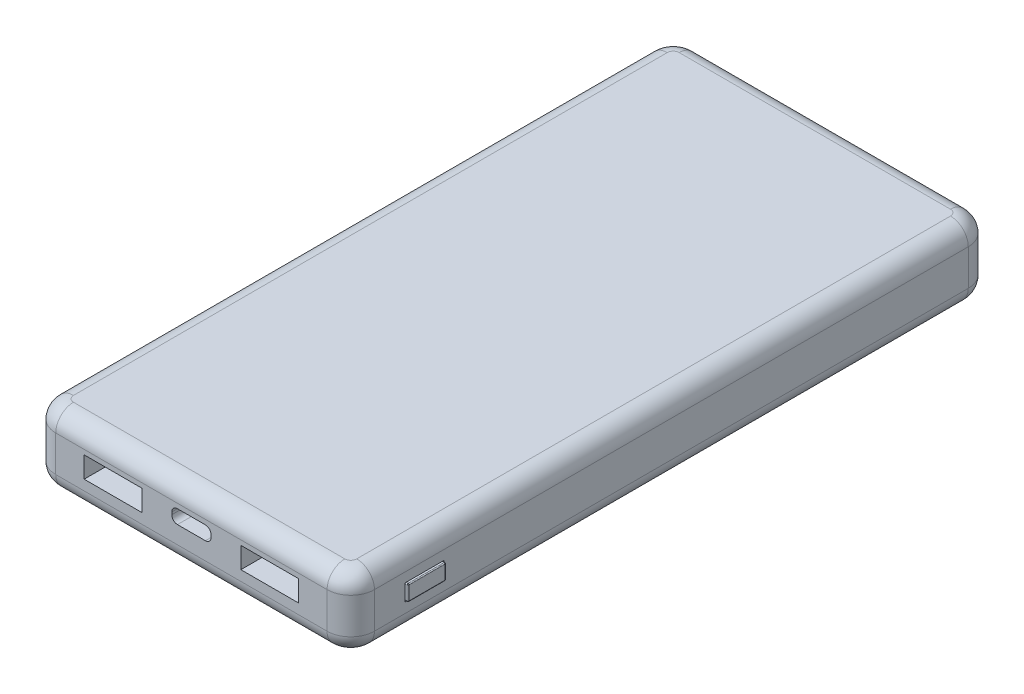
from build123d import *

# Parameters (mm, degrees)
SKETCH1_W           = 67.3
SKETCH1_H           = 135.4
BOSS_EXTRUDE1_DEPTH = 15.1
FILLET1_R           = 5
FILLET2_R           = 3.75
SKETCH2_W           = 12.2
SKETCH2_H           = 4.45
CUT_EXTRUDE1_DEPTH  = 6
SKETCH3_W           = 8.2
SKETCH3_H           = 3.5
SKETCH3_W_2         = 8
SKETCH3_H_2         = 3.3
CUT_EXTRUDE2_DEPTH  = 3
FILLET3_R           = 3.75
SKETCH4_W           = 8
SKETCH4_H           = 3.3
BOSS_EXTRUDE2_DEPTH = 0.5
FILLET4_R           = 0.2
FILLET5_R           = 0.2
BOSS_EXTRUDE3_DEPTH = 2.1


with BuildPart() as part:
    # Sketch1 → Boss-Extrude1 (new body)
    with BuildSketch(Plane(origin=(0, 0, 0), x_dir=(1, 0, 0), z_dir=(0, 1, 0))):
        with Locations((33.65, 67.7)):
            Rectangle(SKETCH1_W, SKETCH1_H)
    extrude(amount=BOSS_EXTRUDE1_DEPTH)

    # Fillet1
    fillet1_edges = [part.edges().sort_by_distance(p)[0] for p in [
        (0, 7.55, -135.4),
        (67.3, 7.55, -135.4),
        (67.3, 7.55, 0),
        (0, 7.55, 0),
    ]]
    fillet(fillet1_edges, radius=FILLET1_R)

    # Fillet2
    fillet2_edges = [part.edges().sort_by_distance(p)[0] for p in [
        (1.464466094, 15.1, -1.464466094),
        (0, 15.1, -67.7),
        (1.464466094, 15.1, -133.935533906),
        (33.65, 15.1, -135.4),
        (65.835533906, 15.1, -133.935533906),
        (67.3, 15.1, -67.7),
        (65.835533906, 15.1, -1.464466094),
        (33.65, 15.1, 0),
    ]]
    fillet(fillet2_edges, radius=FILLET2_R)

    # Sketch2 → Cut-Extrude1 (cut)
    with BuildSketch(Plane.XY):
        with Locations((17.1, 8.125)):
            Rectangle(SKETCH2_W, SKETCH2_H)
        with Locations((50.2, 8.125)):
            Rectangle(SKETCH2_W, SKETCH2_H)
        with BuildLine():
            Line((30.7, 7.45), (36.6, 7.45))
            ThreePointArc((36.6, 7.45), (37.448528137, 7.801471863), (37.8, 8.65))
            Line((37.8, 8.65), (37.8, 9.15))
            ThreePointArc((37.8, 9.15), (37.448528137, 9.998528137), (36.6, 10.35))
            Line((36.6, 10.35), (30.7, 10.35))
            ThreePointArc((30.7, 10.35), (29.851471863, 9.998528137), (29.5, 9.15))
            Line((29.5, 9.15), (29.5, 8.65))
            ThreePointArc((29.5, 8.65), (29.851471863, 7.801471863), (30.7, 7.45))
        make_face()
    extrude(amount=-CUT_EXTRUDE1_DEPTH, mode=Mode.SUBTRACT)

    # Sketch3 → Cut-Extrude2 (cut)
    with BuildSketch(Plane(origin=(67.3, 0, 0), x_dir=(0, 0, -1), z_dir=(1, 0, 0))):
        with Locations((15.6, 7.6)):
            Rectangle(SKETCH3_W, SKETCH3_H)
        with Locations((15.6, 7.6)):
            Rectangle(SKETCH3_W_2, SKETCH3_H_2, mode=Mode.SUBTRACT)
    extrude(amount=-CUT_EXTRUDE2_DEPTH, mode=Mode.SUBTRACT)

    # Fillet3
    fillet3_edges = [part.edges().sort_by_distance(p)[0] for p in [
        (1.464466094, 0, -1.464466094),
        (0, 0, -67.7),
        (1.464466094, 0, -133.935533906),
        (33.65, 0, -135.4),
        (65.835533906, 0, -133.935533906),
        (67.3, 0, -67.7),
        (65.835533906, 0, -1.464466094),
        (33.65, 0, 0),
    ]]
    fillet(fillet3_edges, radius=FILLET3_R)

    # Sketch4 → Boss-Extrude2 (add)
    with BuildSketch(Plane(origin=(67.3, 0, 0), x_dir=(0, 0, -1), z_dir=(1, 0, 0))):
        with Locations((15.6, 7.6)):
            Rectangle(SKETCH4_W, SKETCH4_H)
    extrude(amount=BOSS_EXTRUDE2_DEPTH)

    # Fillet4
    fillet4_edges = [part.edges().sort_by_distance(p)[0] for p in [
        (66.05, 5.95, -11.6),
        (66.05, 5.95, -19.6),
        (66.05, 9.25, -19.6),
        (66.05, 9.25, -11.6),
    ]]
    fillet(fillet4_edges, radius=FILLET4_R)

    # Fillet5
    fillet5_edges = [part.edges().sort_by_distance(p)[0] for p in [
        (67.8, 9.191421356, -19.541421356),
        (67.8, 7.6, -19.6),
        (67.8, 6.008578644, -19.541421356),
        (67.8, 5.95, -15.6),
        (67.8, 6.008578644, -11.658578644),
        (67.8, 7.6, -11.6),
        (67.8, 9.191421356, -11.658578644),
        (67.8, 9.25, -15.6),
    ]]
    fillet(fillet5_edges, radius=FILLET5_R)

    # Sketch5 → Boss-Extrude3 (add)
    with BuildSketch(Plane.XY.offset(-6)):
        with BuildLine():
            Line((30.74, 8.35), (36.56, 8.35))
            ThreePointArc((36.56, 8.35), (36.941837662, 8.508162338), (37.1, 8.89))
            Line((37.1, 8.89), (37.1, 8.91))
            ThreePointArc((37.1, 8.91), (36.941837662, 9.291837662), (36.56, 9.45))
            Line((36.56, 9.45), (30.74, 9.45))
            ThreePointArc((30.74, 9.45), (30.358162338, 9.291837662), (30.2, 8.91))
            Line((30.2, 8.91), (30.2, 8.89))
            ThreePointArc((30.2, 8.89), (30.358162338, 8.508162338), (30.74, 8.35))
        make_face()
    extrude(amount=BOSS_EXTRUDE3_DEPTH)


solid = part.part
